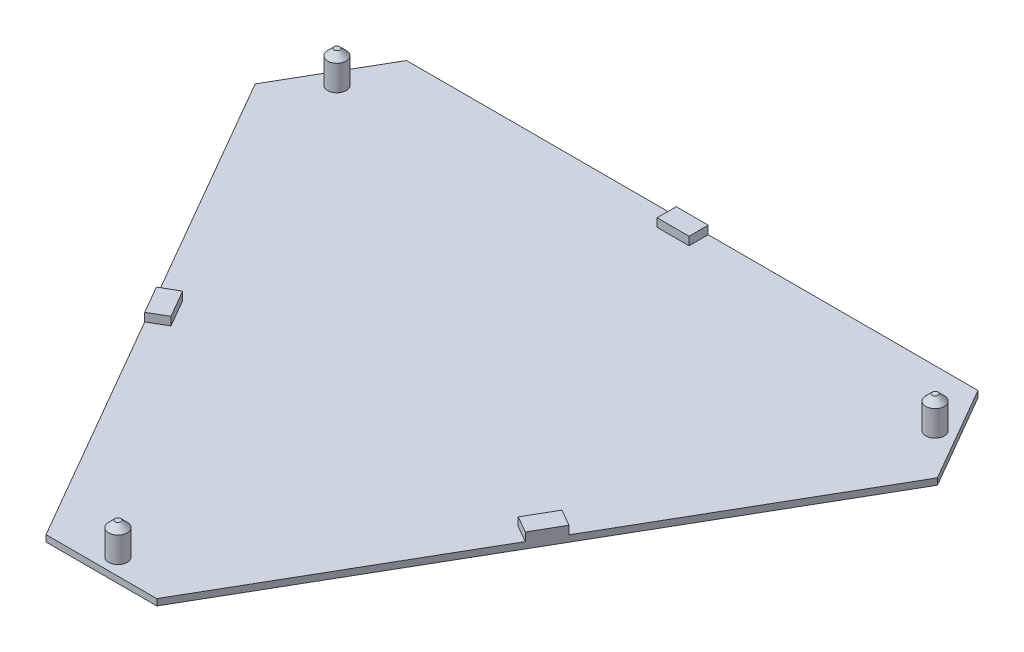
from build123d import *

# Parameters (mm, degrees)
BOSS_EXTRU_2_DEPTH      = 1
ESQUISSE3_R             = 1.45
BOSS_EXTRU_3_DEPTH      = 5
CHANFREIN1_SIZE         = 1
BOSS_EXTRU_4_DEPTH      = 1.3
BOSS_EXTRU_4_DEPTH_BACK = 1
ESQUISSE4_W             = 5
ESQUISSE4_H             = 3


with BuildPart() as part:
    # Esquisse2 → Boss.-Extru.2 (new body)
    with BuildSketch(Plane(origin=(0, 0, 0), x_dir=(1, 0, 0), z_dir=(0, 1, 0))):
        Polygon((-53.339745962, 20.79571669), (-44.679491924, 35.79571669), (44.679491924, 35.79571669), (53.339745962, 20.79571669), (8.660254038, -56.59143338), (-8.660254038, -56.59143338), align=None)
    extrude(amount=BOSS_EXTRU_2_DEPTH)

    # Esquisse3 → Boss.-Extru.3 (add)
    with BuildSketch(Plane(origin=(0, 1, 0), x_dir=(1, 0, 0), z_dir=(0, 1, 0))):
        with Locations(Location((0, -54, 0), (0, 0, 90))):
            Circle(ESQUISSE3_R)
        with Locations(Location((-46.765371804, 27, 0), (0, 0, 90))):
            Circle(ESQUISSE3_R)
        with Locations(Location((46.765371804, 27, 0), (0, 0, 90))):
            Circle(ESQUISSE3_R)
    extrude(amount=BOSS_EXTRU_3_DEPTH)

    # Chanfrein1
    chanfrein1_edges = [part.edges().sort_by_distance(p)[0] for p in [
        (0, 6, 55.45),
        (-46.765371804, 6, -25.55),
        (46.765371804, 6, -25.55),
    ]]
    chamfer(chanfrein1_edges, length=CHANFREIN1_SIZE)

    # Esquisse4 → Boss.-Extru.4 (add, two sides: drawn at the far end of the back side and taken through both)
    with BuildSketch(Plane(origin=(0, 1, 0), x_dir=(1, 0, 0), z_dir=(0, 1, 0)).offset(-BOSS_EXTRU_4_DEPTH_BACK)):
        with Locations((0, 34.29571669)):
            Rectangle(ESQUISSE4_W, ESQUISSE4_H)
        Polygon((32.25, -15.732794835), (29.75, -20.062921854), (27.151923789, -18.562921854), (29.651923789, -14.232794835), align=None)
        Polygon((-29.75, -20.062921854), (-32.25, -15.732794835), (-29.651923789, -14.232794835), (-27.151923789, -18.562921854), align=None)
    extrude(amount=BOSS_EXTRU_4_DEPTH + BOSS_EXTRU_4_DEPTH_BACK)


solid = part.part
